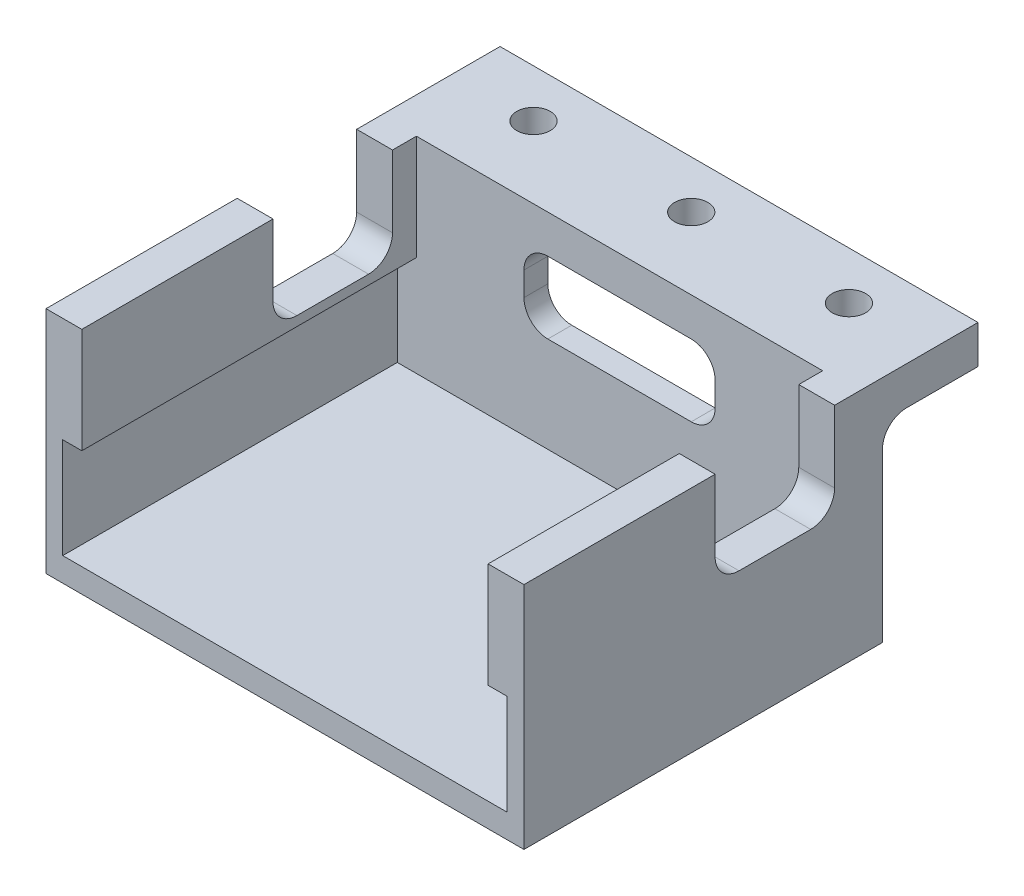
from build123d import *

# Parameters (mm, degrees)
SKETCH2_W           = 50
SKETCH2_H           = 24
SKETCH2_W_2         = 46.5
SKETCH2_H_2         = 10.5
SKETCH2_W_3         = 42.5
SKETCH2_H_3         = 11
BOSS_EXTRUDE1_DEPTH = 47.5
CUT_EXTRUDE1_START  = 47.5
SKETCH2_3_W         = 46.5
SKETCH2_3_H         = 10.5
SKETCH2_3_W_2       = 42.5
SKETCH2_3_H_2       = 11
CUT_EXTRUDE1_DEPTH  = 35
SKETCH3_W           = 50
SKETCH3_H           = 10
SKETCH3_R           = 1.75
CUT_EXTRUDE2_DEPTH  = 20
SKETCH3_3_R         = 1.75
CUT_EXTRUDE3_DEPTH  = 24
CUT_EXTRUDE4_REACH  = 72.002
SKETCH4_W           = 12.5
SKETCH4_H           = 10
SKETCH5_W           = 20
SKETCH5_H           = 7.5
CUT_EXTRUDE5_DEPTH  = 2.5
FILLET1_R           = 2.5


with BuildPart() as part:
    # Sketch2 → Boss-Extrude1 (new body)
    # profile 1 of 3: a face of its own
    with BuildSketch(Plane.XY):
        Rectangle(SKETCH2_W, SKETCH2_H)
        with Locations((0, -4.25)):
            Rectangle(SKETCH2_W_2, SKETCH2_H_2, mode=Mode.SUBTRACT)
    # profile 2 of 3: a face of its own
    with BuildSketch(Plane.XY):
        with Locations((0, -4.25)):
            Rectangle(SKETCH2_W_2, SKETCH2_H_2)
    # profile 3 of 3: a face of its own
    with BuildSketch(Plane.XY):
        with Locations((0, 6.5)):
            Rectangle(SKETCH2_W_3, SKETCH2_H_3)
    extrude(amount=BOSS_EXTRUDE1_DEPTH)

    # Sketch2<3> → Cut-Extrude1 (cut)
    with BuildSketch(Plane.XY.offset(CUT_EXTRUDE1_START)):
        with Locations((0, -4.25)):
            Rectangle(SKETCH2_3_W, SKETCH2_3_H)
        with Locations((0, 6.5)):
            Rectangle(SKETCH2_3_W_2, SKETCH2_3_H_2)
    extrude(amount=-CUT_EXTRUDE1_DEPTH, mode=Mode.SUBTRACT)

    # Sketch3 → Cut-Extrude2 (cut)
    # profile 1 of 4: a face of its own
    with BuildSketch(Plane.XZ.offset(12)):
        with Locations((0, 5)):
            Rectangle(SKETCH3_W, SKETCH3_H)
        with Locations((-16.5, 5)):
            Circle(SKETCH3_R, mode=Mode.SUBTRACT)
        with Locations((0, 5)):
            Circle(SKETCH3_R, mode=Mode.SUBTRACT)
        with Locations((16.5, 5)):
            Circle(SKETCH3_R, mode=Mode.SUBTRACT)
    # profile 2 of 4: a face of its own
    with BuildSketch(Plane.XZ.offset(12)):
        with Locations((-16.5, 5)):
            Circle(SKETCH3_R)
    # profile 3 of 4: a face of its own
    with BuildSketch(Plane.XZ.offset(12)):
        with Locations((0, 5)):
            Circle(SKETCH3_R)
    # profile 4 of 4: a face of its own
    with BuildSketch(Plane.XZ.offset(12)):
        with Locations((16.5, 5)):
            Circle(SKETCH3_R)
    extrude(amount=-CUT_EXTRUDE2_DEPTH, mode=Mode.SUBTRACT)

    # Sketch3<3> → Cut-Extrude3 (cut)
    with BuildSketch(Plane.XZ.offset(12)):
        with Locations(Location((-16.5, 5, 0), (0, 0, 270))):
            Circle(SKETCH3_3_R)
        with Locations(Location((0, 5, 0), (0, 0, 270))):
            Circle(SKETCH3_3_R)
        with Locations(Location((16.5, 5, 0), (0, 0, 270))):
            Circle(SKETCH3_3_R)
    extrude(amount=-CUT_EXTRUDE3_DEPTH, mode=Mode.SUBTRACT)

    # Cut-Extrude4: up to this face of the body (flat: up to its plane)
    cut_extrude4_end = Plane(part.part.faces().sort_by_distance((-25, 0.425531915, 27.739361702))[0])
    # Sketch4 → Cut-Extrude4 (cut, up to the picked face)
    with BuildSketch(Plane(origin=(25, 0, 0), x_dir=(0, 0, -1), z_dir=(1, 0, 0)), mode=Mode.PRIVATE) as cut_extrude4_sk1:
        with Locations((-21.25, 7)):
            Rectangle(SKETCH4_W, SKETCH4_H)
    cut_extrude4_tool1 = split(extrude(cut_extrude4_sk1.sketch, amount=-CUT_EXTRUDE4_REACH, mode=Mode.PRIVATE), bisect_by=cut_extrude4_end, keep=Keep.BOTH, mode=Mode.PRIVATE)
    add(cut_extrude4_tool1.solids().sort_by(Axis((25, 7, 21.25), (-1, 0, 0)))[0], mode=Mode.SUBTRACT)

    # Sketch5 → Cut-Extrude5 (cut)
    with BuildSketch(Plane.XY.offset(12.5)):
        with Locations((0, 4.25)):
            Rectangle(SKETCH5_W, SKETCH5_H)
    extrude(amount=-CUT_EXTRUDE5_DEPTH, mode=Mode.SUBTRACT)

    # Fillet1
    fillet1_edges = [part.edges().sort_by_distance(p)[0] for p in [
        (-23.125, 2, 15),
        (-23.125, 2, 27.5),
        (23.125, 2, 15),
        (23.125, 2, 27.5),
        (17.5, 8, 10),
        (-10, 8, 11.25),
        (10, 8, 11.25),
        (10, 0.5, 11.25),
        (-10, 0.5, 11.25),
        (-17.5, 8, 10),
    ]]
    fillet(fillet1_edges, radius=FILLET1_R)


solid = part.part
